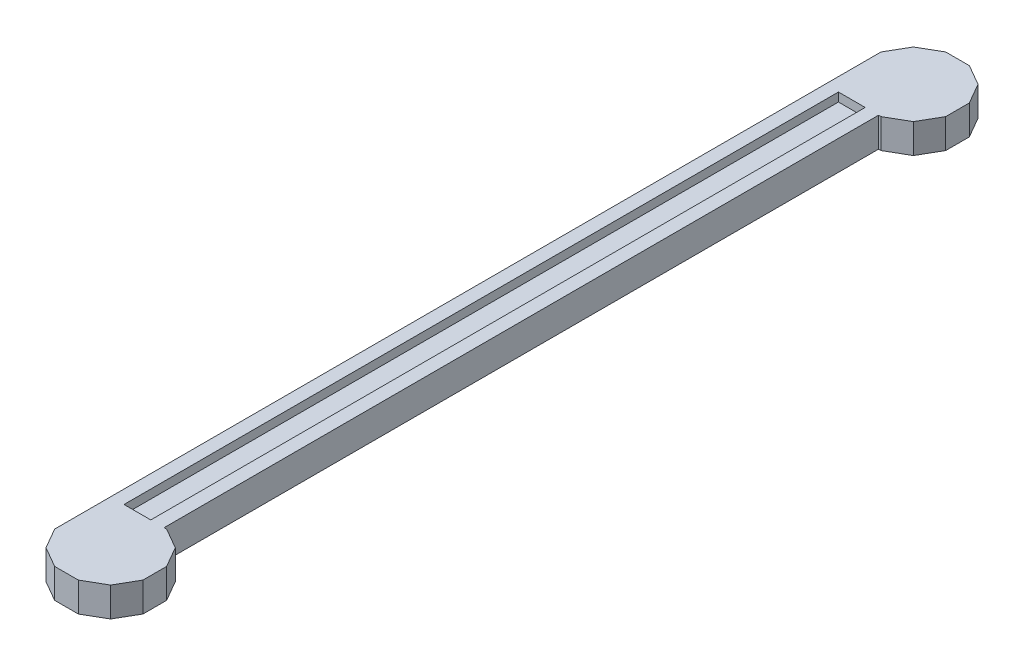
from build123d import *

# Parameters (mm, degrees)
BOSS_EXTRUDE1_DEPTH = 22
CUT_EXTRUDE1_DEPTH  = 635.24127901
SKETCH3_W           = 20
SKETCH3_H           = 534
CUT_EXTRUDE2_DEPTH  = 6.5
SKETCH4_W           = 20
SKETCH4_H           = 534
CUT_EXTRUDE3_DEPTH  = 6.5


with BuildPart() as part:
    # Sketch1 → Boss-Extrude1 (new body)
    with BuildSketch(Plane(origin=(0, 11, 0), x_dir=(1, 0, 0), z_dir=(0, 1, 0))):
        Polygon((24.15767665, 24.15767665), (8.84232335, 33), (-8.84232335, 33), (-24.15767665, 24.15767665), (-33, 8.84232335), (-33, -608.84232335), (-24.15767665, -624.15767665), (-8.84232335, -633), (8.84232335, -633), (24.15767665, -624.15767665), (33, -608.84232335), (33, 8.84232335), align=None)
    extrude(amount=-BOSS_EXTRUDE1_DEPTH)

    # Sketch2 → Cut-Extrude1 (cut, through all)
    with BuildSketch(Plane.XZ.offset(11)):
        Polygon((33, 8.84232335), (33, 591.15767665), (24.15767665, 575.84232335), (8.84232335, 567), (7, 567), (7, 33), (8.84232335, 33), (24.15767665, 24.15767665), align=None)
    extrude(amount=-CUT_EXTRUDE1_DEPTH, mode=Mode.SUBTRACT)

    # Sketch3 → Cut-Extrude2 (cut)
    with BuildSketch(Plane.XZ.offset(11)):
        with Locations((-13, 300)):
            Rectangle(SKETCH3_W, SKETCH3_H)
    extrude(amount=-CUT_EXTRUDE2_DEPTH, mode=Mode.SUBTRACT)

    # Sketch4 → Cut-Extrude3 (cut)
    with BuildSketch(Plane(origin=(0, 11, 0), x_dir=(-1, 0, 0), z_dir=(0, 1, 0))):
        with Locations((13, 300)):
            Rectangle(SKETCH4_W, SKETCH4_H)
    extrude(amount=-CUT_EXTRUDE3_DEPTH, mode=Mode.SUBTRACT)


solid = part.part
